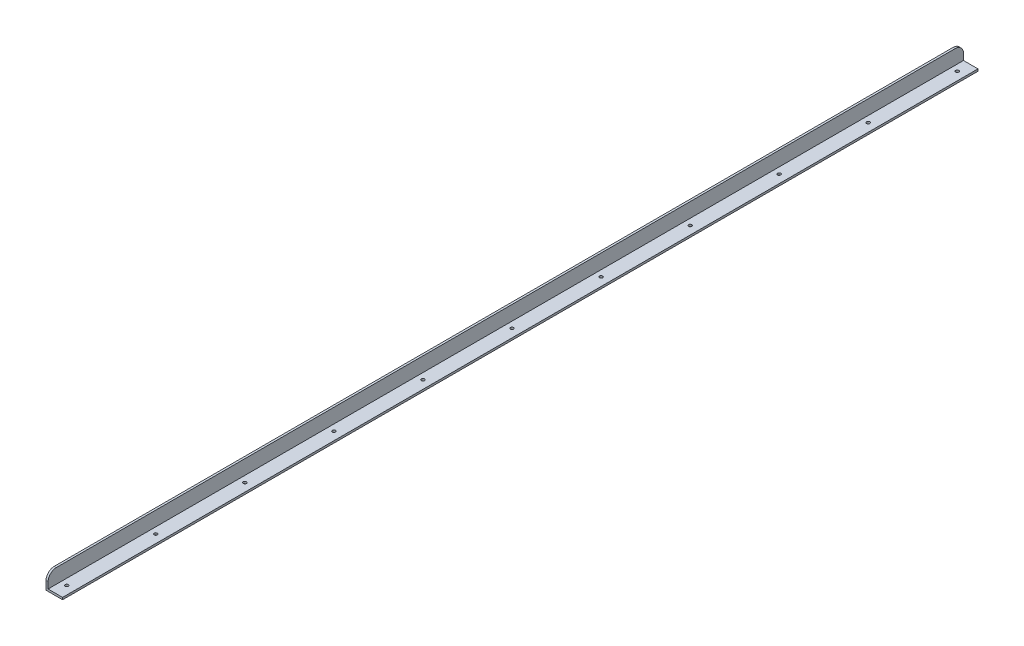
from build123d import *

# Parameters (mm, degrees)
EXTRUDE1_DEPTH     = 1403.35
SKETCH2_R          = 2.4257
CUT_EXTRUDE2_DEPTH = 1404.809653229
LPATTERN1_COUNT    = 11
LPATTERN1_PITCH    = 136.525
FILLET1_R          = 12.7


with BuildPart() as part:
    # Sketch1 → Extrude1 (new body)
    with BuildSketch(Plane.XY):
        Polygon((0, 0), (25.4, 0), (25.4, 3.175), (3.175, 3.175), (3.175, 25.4), (0, 25.4), align=None)
    extrude(amount=-EXTRUDE1_DEPTH)

    # Sketch2 → Cut-Extrude2 (cut, through all)
    with BuildSketch(Plane(origin=(0, 0, 0), x_dir=(1, 0, 0), z_dir=(0, 1, 0))):
        with Locations(Location((12.7, 19.05, 0), (0, 0, 180))):
            Circle(SKETCH2_R)
    cut_extrude2 = extrude(amount=CUT_EXTRUDE2_DEPTH, mode=Mode.SUBTRACT)

    # LPattern1: Cut-Extrude2 ×11
    with Locations(*[(0, 0, -i * LPATTERN1_PITCH) for i in range(1, LPATTERN1_COUNT)]):
        add(cut_extrude2, mode=Mode.SUBTRACT)

    # Fillet1
    fillet1_edges = [part.edges().sort_by_distance(p)[0] for p in [
        (1.5875, 25.4, -1403.35),
        (1.5875, 25.4, 0),
    ]]
    fillet(fillet1_edges, radius=FILLET1_R)


solid = part.part
